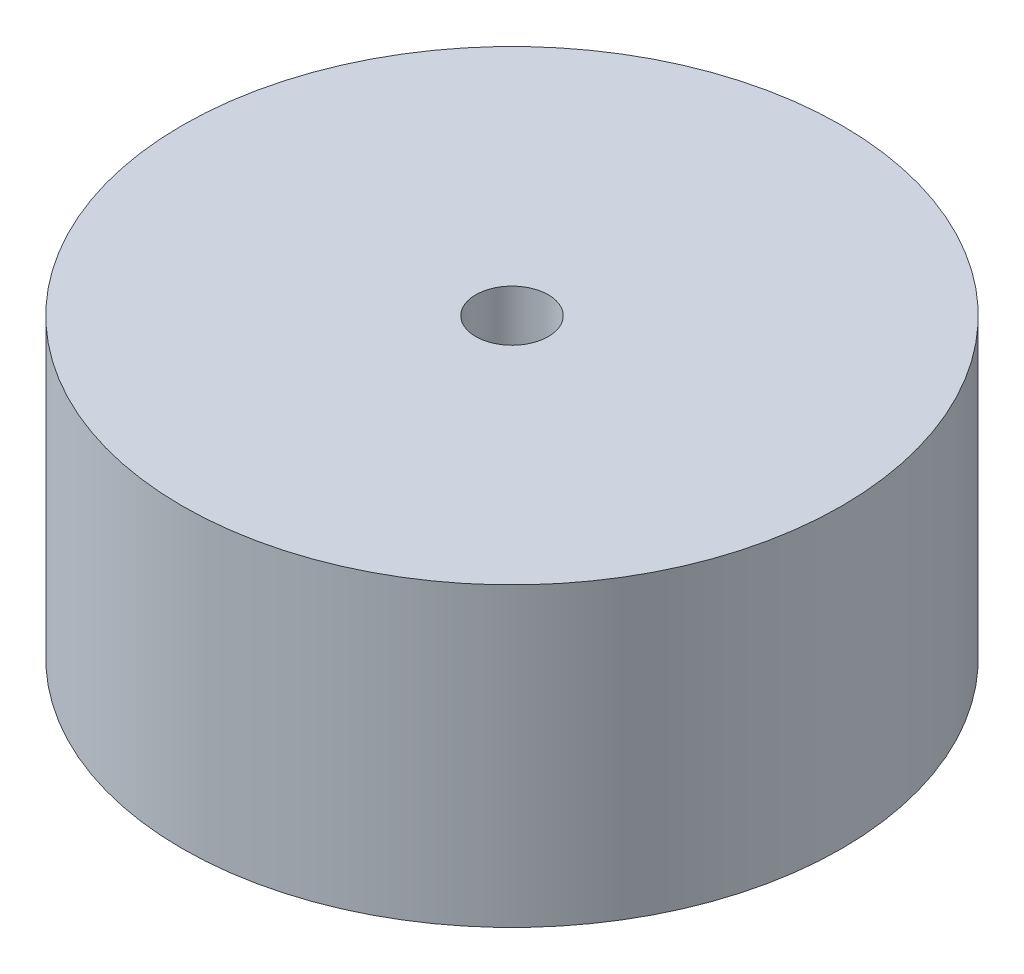
from build123d import *

# Parameters (mm, degrees)
ESBO_O1_R                = 50
ESBO_O1_R_2              = 5.5
RESSALTO_EXTRUS_O1_DEPTH = 45


with BuildPart() as part:
    # Esboço1 → Ressalto-extrusão1 (new body)
    with BuildSketch(Plane(origin=(0, 0, 0), x_dir=(1, 0, 0), z_dir=(0, 1, 0))):
        with Locations(Location((0, 0, 0), (0, 0, 90))):
            Circle(ESBO_O1_R)
        with Locations(Location((0, 0, 0), (0, 0, 90))):
            Circle(ESBO_O1_R_2, mode=Mode.SUBTRACT)
    extrude(amount=RESSALTO_EXTRUS_O1_DEPTH)


solid = part.part
